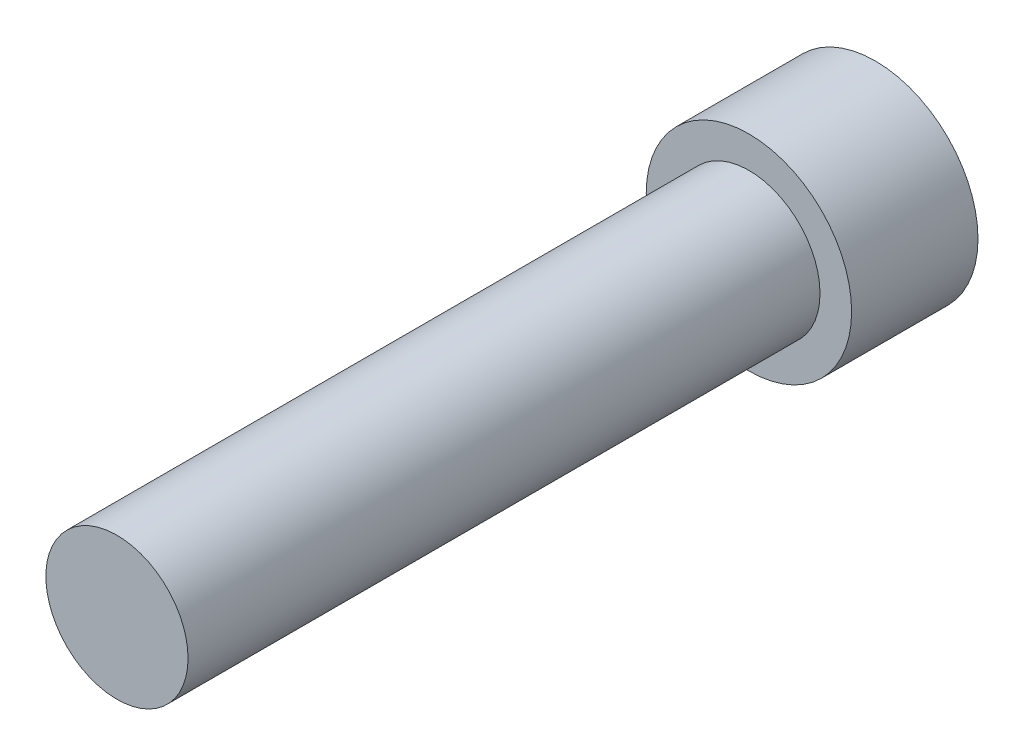
from build123d import *

# Parameters (mm, degrees)
SKETCH_1_R          = 4.5
EXTRUDE_1_DEPTH     = 40
SKETCH_2_R          = 6.5
EXTRUDE_2_DEPTH     = 8
CUT_EXTRUDE_1_DEPTH = 4


with BuildPart() as part:
    # 스케치1 → 보스-돌출1 (new body)
    with BuildSketch(Plane.XY):
        Circle(SKETCH_1_R)
    extrude(amount=EXTRUDE_1_DEPTH)

    # 스케치2 → 보스-돌출2 (add)
    with BuildSketch(Plane(origin=(0, 0, 0), x_dir=(-1, 0, 0), z_dir=(0, 0, -1))):
        Circle(SKETCH_2_R)
    extrude(amount=EXTRUDE_2_DEPTH)

    # 스케치3 → 컷-돌출1 (cut)
    with BuildSketch(Plane(origin=(0, 0, -8), x_dir=(-1, 0, 0), z_dir=(0, 0, -1))):
        with BuildLine():
            Line((1.51655612, -2.298562783), (2.733251781, -0.335660595))
            ThreePointArc((2.733251781, -0.335660595), (2.80802632, -0.087878298), (2.748891822, 0.164094734))
            Line((2.748891822, 0.164094734), (1.657316493, 2.19923518))
            ThreePointArc((1.657316493, 2.19923518), (1.480117999, 2.387882979), (1.232335703, 2.462657518))
            Line((1.232335703, 2.462657518), (-1.075935288, 2.534895775))
            ThreePointArc((-1.075935288, 2.534895775), (-1.327908321, 2.475761277), (-1.51655612, 2.298562783))
            Line((-1.51655612, 2.298562783), (-2.733251781, 0.335660595))
            ThreePointArc((-2.733251781, 0.335660595), (-2.80802632, 0.087878298), (-2.748891822, -0.164094734))
            Line((-2.748891822, -0.164094734), (-1.657316493, -2.19923518))
            ThreePointArc((-1.657316493, -2.19923518), (-1.480117999, -2.387882979), (-1.232335703, -2.462657518))
            Line((-1.232335703, -2.462657518), (1.075935288, -2.534895775))
            ThreePointArc((1.075935288, -2.534895775), (1.327908321, -2.475761277), (1.51655612, -2.298562783))
        make_face()
    extrude(amount=-CUT_EXTRUDE_1_DEPTH, mode=Mode.SUBTRACT)


solid = part.part
